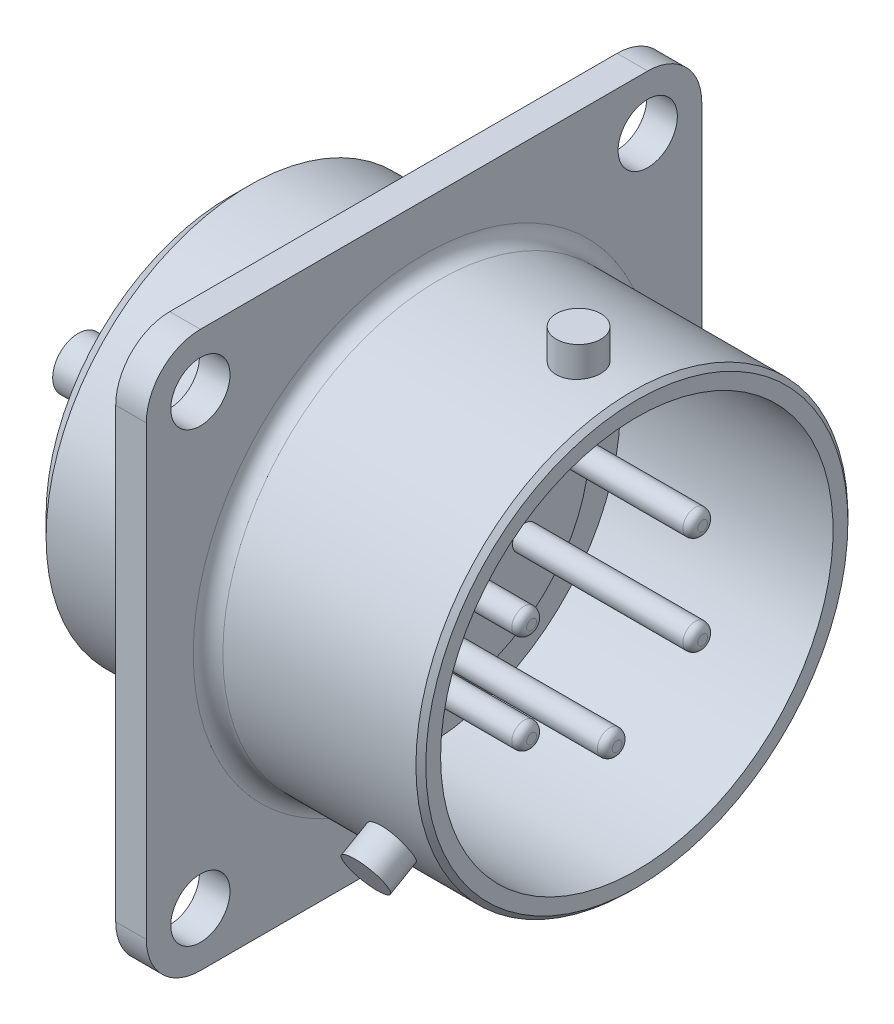
from build123d import *

# Parameters (mm, degrees)
SKETCH2_OUTSIDE_W         = 96.1
SKETCH2_OUTSIDE_H         = 96.1
SKETCH2_OUTSIDE_R         = 1.524
CE_00_BODY_FLANGE_DEPTH   = 1.5748
SKETCH5_W                 = 1.143
SKETCH5_H                 = 2.032
CP_00_BAYONETE_PINS_COUNT = 3
SKETCH3_R                 = 1.3208
SKETCH3_R_2               = 0.8128
BE_00_TERMINAL_DEPTH      = 3.3782
CP_00_TERMINAL_COUNT      = 6
SKETCH9_R                 = 0.635
BOSS_EXTRUDE1_DEPTH       = 9.144
FILLET1_R                 = 0.381
CIRPATTERN1_COUNT         = 6
FILLET1_OF_CIRPATTERN1_R  = 0.381


with BuildPart() as part:
    # Sketch1 → BR-00 Body Revolve (revolve)
    with BuildSketch(Plane.XY, mode=Mode.PRIVATE) as br_00_body_revolve_sk:
        with BuildLine():
            Line((1.5748, 11.8745), (1.5748, 36.5125))
            Line((1.5748, 36.5125), (0, 36.5125))
            Line((0, 36.5125), (0, 10.8331))
            ThreePointArc((0, 10.8331), (-0.111592316, 10.563692316), (-0.381, 10.4521))
            Line((-0.381, 10.4521), (-7.4168, 10.4521))
            Line((-7.4168, 10.4521), (-8.4328, 9.4361))
            Line((-8.4328, 9.4361), (-8.4328, 0))
            Line((-8.4328, 0), (2.3622, 0))
            Line((2.3622, 0), (2.3622, 7.7343))
            Line((2.3622, 7.7343), (1.5748, 7.7343))
            Line((1.5748, 7.7343), (1.5748, 10.0965))
            Line((1.5748, 10.0965), (12.5222, 10.0965))
            Line((12.5222, 10.0965), (12.5222, 10.8585))
            Line((12.5222, 10.8585), (12.2682, 11.1125))
            Line((12.2682, 11.1125), (2.3368, 11.1125))
            ThreePointArc((2.3368, 11.1125), (1.797984633, 11.335684633), (1.5748, 11.8745))
        make_face()
    revolve(br_00_body_revolve_sk.sketch.rotate(Axis((25.6286, 0, 0), (1, 0, 0)), 90), axis=Axis((25.6286, 0, 0), (1, 0, 0)))

    # Sketch2 outside → CE-00 Body Flange (cut)
    # profile 1 of 5: a face of its own
    with BuildSketch(Plane(origin=(0, 0, 0), x_dir=(0, 0, -1), z_dir=(1, 0, 0))):
        Rectangle(SKETCH2_OUTSIDE_W, SKETCH2_OUTSIDE_H)
        with BuildLine():
            Line((-11.5062, 14.2875), (11.5062, 14.2875))
            ThreePointArc((11.5062, 14.2875), (13.472876091, 13.472876091), (14.2875, 11.5062))
            Line((14.2875, 11.5062), (14.2875, -11.5062))
            ThreePointArc((14.2875, -11.5062), (13.472876091, -13.472876091), (11.5062, -14.2875))
            Line((11.5062, -14.2875), (-11.5062, -14.2875))
            ThreePointArc((-11.5062, -14.2875), (-13.472876091, -13.472876091), (-14.2875, -11.5062))
            Line((-14.2875, -11.5062), (-14.2875, 11.5062))
            ThreePointArc((-14.2875, 11.5062), (-13.472876091, 13.472876091), (-11.5062, 14.2875))
        make_face(mode=Mode.SUBTRACT)
    # profile 2 of 5: a face of its own
    with BuildSketch(Plane(origin=(0, 0, 0), x_dir=(0, 0, -1), z_dir=(1, 0, 0))):
        with Locations(Location((11.5062, 11.5062, 0), (0, 0, 180))):
            Circle(SKETCH2_OUTSIDE_R)
    # profile 3 of 5: a face of its own
    with BuildSketch(Plane(origin=(0, 0, 0), x_dir=(0, 0, -1), z_dir=(1, 0, 0))):
        with Locations(Location((11.5062, -11.5062, 0), (0, 0, 180))):
            Circle(SKETCH2_OUTSIDE_R)
    # profile 4 of 5: a face of its own
    with BuildSketch(Plane(origin=(0, 0, 0), x_dir=(0, 0, -1), z_dir=(1, 0, 0))):
        with Locations(Location((-11.5062, -11.5062, 0), (0, 0, 180))):
            Circle(SKETCH2_OUTSIDE_R)
    # profile 5 of 5: a face of its own
    with BuildSketch(Plane(origin=(0, 0, 0), x_dir=(0, 0, -1), z_dir=(1, 0, 0))):
        with Locations(Location((-11.5062, 11.5062, 0), (0, 0, 180))):
            Circle(SKETCH2_OUTSIDE_R)
    extrude(amount=CE_00_BODY_FLANGE_DEPTH, mode=Mode.SUBTRACT)

    # Sketch5 → BR-00 Bayonete Pin (revolve)
    with BuildSketch(Plane.XY, mode=Mode.PRIVATE) as br_00_bayonete_pin_sk:
        with Locations((10.0965, 11.6205)):
            Rectangle(SKETCH5_W, SKETCH5_H)
    br_00_bayonete_pin = revolve(br_00_bayonete_pin_sk.sketch.rotate(Axis((9.525, 12.6365, 0), (0, -1, 0)), 180), axis=Axis((9.525, 12.6365, 0), (0, -1, 0)))

    # CP-00 Bayonete Pins: BR-00 Bayonete Pin ×3 about axis
    cp_00_bayonete_pins_axis = Axis((0, 0, 0), (1, 0, 0))
    for i in range(1, CP_00_BAYONETE_PINS_COUNT):
        add(br_00_bayonete_pin.rotate(cp_00_bayonete_pins_axis, i * 360 / CP_00_BAYONETE_PINS_COUNT))

    # Sketch3 → BE-00 Terminal (add)
    with BuildSketch(Plane.ZY.offset(8.4328)):
        with Locations(Location((4.399409051, 2.54, 0), (0, 0, 180))):
            Circle(SKETCH3_R)
        with Locations((4.399409051, 2.54)):
            Circle(SKETCH3_R_2, mode=Mode.SUBTRACT)
    be_00_terminal = extrude(amount=BE_00_TERMINAL_DEPTH)

    # CP-00 Terminal: BE-00 Terminal ×6 about axis, 1 skipped
    cp_00_terminal_axis = Axis((0, 0, 0), (1, 0, 0))
    add([be_00_terminal.rotate(cp_00_terminal_axis, i * 360 / CP_00_TERMINAL_COUNT) for i in range(1, CP_00_TERMINAL_COUNT) if i not in (5,)])

    # Sketch9 → Boss-Extrude1 (add)
    with BuildSketch(Plane(origin=(2.3622, 0, 0), x_dir=(0, 0, -1), z_dir=(1, 0, 0))):
        with Locations(Location((-4.399409051, 2.54, 0), (0, 0, 180))):
            Circle(SKETCH9_R)
    boss_extrude1 = extrude(amount=BOSS_EXTRUDE1_DEPTH)

    # Fillet1
    fillet1_edges = [part.edges().sort_by_distance(p)[0] for p in [
        (11.5062, 2.54, 3.764409051),
    ]]
    fillet(fillet1_edges, radius=FILLET1_R)

    # CirPattern1: Boss-Extrude1 ×6 about axis, 1 skipped
    cirpattern1_axis = Axis((0, 0, 0), (1, 0, 0))
    add([boss_extrude1.rotate(cirpattern1_axis, i * 360 / CIRPATTERN1_COUNT) for i in range(1, CIRPATTERN1_COUNT) if i not in (5,)])

    # Fillet1 of CirPattern1
    fillet1_of_cirpattern1_edges = [part.edges().sort_by_distance(p)[0] for p in [
        (11.5062, -1.990073869, 4.081909051),
        (11.5062, -4.530073869, 0.3175),
        (11.5062, -2.54, -3.764409051),
        (11.5062, 1.990073869, -4.081909051),
    ]]
    fillet(fillet1_of_cirpattern1_edges, radius=FILLET1_OF_CIRPATTERN1_R)


solid = part.part
